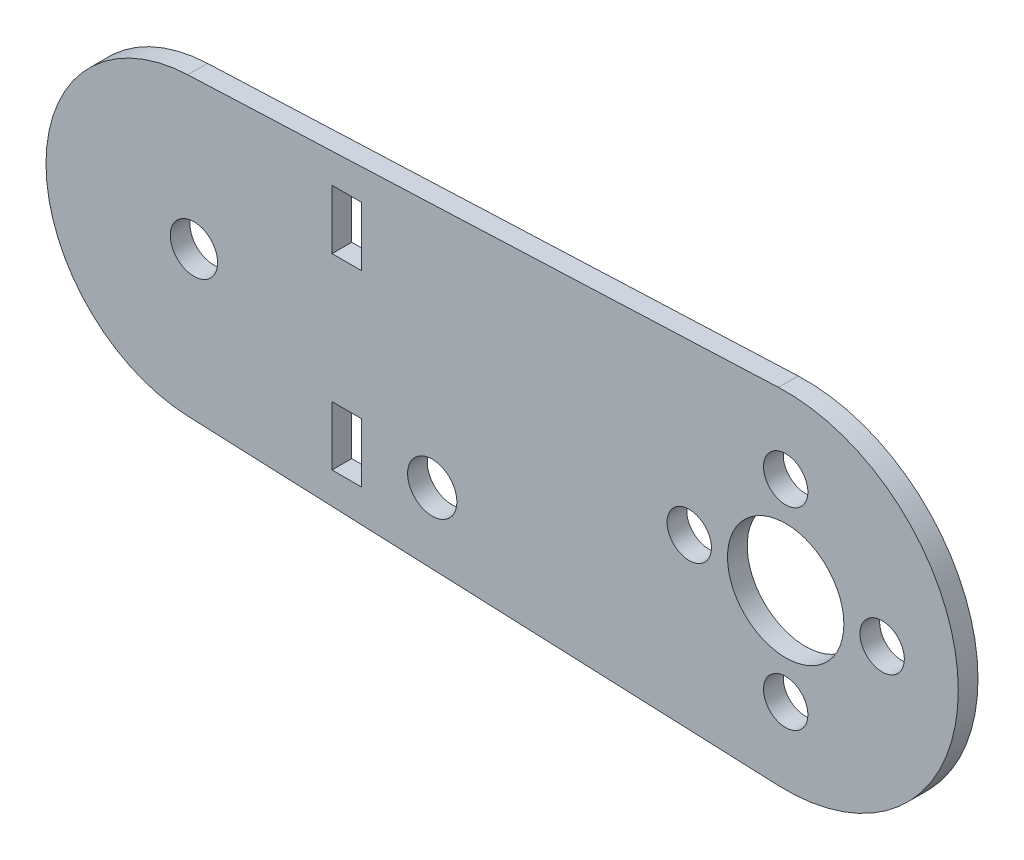
from build123d import *

# Parameters (mm, degrees)
SKETCH1_R           = 17.5
SKETCH1_R_2         = 5.9
SKETCH1_R_3         = 15
BOSS_EXTRUDE1_DEPTH = 2
SKETCH2_R           = 2.25
CUT_EXTRUDE1_DEPTH  = 78.040573726
SKETCH3_R           = 2.4
CUT_EXTRUDE2_DEPTH  = 78.040573726
SKETCH4_W           = 3
SKETCH4_H           = 6
CUT_EXTRUDE3_DEPTH  = 10
SKETCH5_R           = 2.5
CUT_EXTRUDE4_DEPTH  = 78.040573726


with BuildPart() as part:
    # Sketch1 → Boss-Extrude1 (new body)
    # profile 1 of 3: a face of its own
    with BuildSketch(Plane.XY):
        Circle(SKETCH1_R)
        Circle(SKETCH1_R_2, mode=Mode.SUBTRACT)
    # profile 2 of 3: a face of its own
    with BuildSketch(Plane.XY):
        with Locations((-60, 0)):
            Circle(SKETCH1_R_3)
    # profile 3 of 3: a face of its own
    with BuildSketch(Plane.XY):
        with BuildLine():
            Line((-0.729166667, 17.484802429), (-60.625, 14.98697351))
            ThreePointArc((-60.625, 14.98697351), (-49.616720171, 10.825317547), (-45, 0))
            ThreePointArc((-45, 0), (-49.616720171, -10.825317547), (-60.625, -14.98697351))
            Line((-60.625, -14.98697351), (-0.729166667, -17.484802429))
            ThreePointArc((-0.729166667, -17.484802429), (-17.5, 0), (-0.729166667, 17.484802429))
        make_face()
    extrude(amount=BOSS_EXTRUDE1_DEPTH)

    # Sketch2 → Cut-Extrude1 (cut, through all)
    with BuildSketch(Plane.XY.offset(2)):
        with Locations((0, 9.78)):
            Circle(SKETCH2_R)
        with Locations((9.78, 0)):
            Circle(SKETCH2_R)
        with Locations((0, -9.78)):
            Circle(SKETCH2_R)
        with Locations((-9.78, 0)):
            Circle(SKETCH2_R)
    extrude(amount=-CUT_EXTRUDE1_DEPTH, mode=Mode.SUBTRACT)

    # Sketch3 → Cut-Extrude2 (cut, through all)
    with BuildSketch(Plane.XY.offset(2)):
        with Locations((-60, 0)):
            Circle(SKETCH3_R)
    extrude(amount=-CUT_EXTRUDE2_DEPTH, mode=Mode.SUBTRACT)

    # Sketch4 → Cut-Extrude3 (cut)
    with BuildSketch(Plane.XY.offset(2)):
        with Locations((-44.5, -9.405729391)):
            Rectangle(SKETCH4_W, SKETCH4_H)
        with Locations((-44.5, 9.594270609)):
            Rectangle(SKETCH4_W, SKETCH4_H)
    extrude(amount=-CUT_EXTRUDE3_DEPTH, mode=Mode.SUBTRACT)

    # Sketch5 → Cut-Extrude4 (cut, through all)
    with BuildSketch(Plane.XY.offset(2)):
        with Locations((-35.840347269, -8.875222906)):
            Circle(SKETCH5_R)
    extrude(amount=-CUT_EXTRUDE4_DEPTH, mode=Mode.SUBTRACT)


solid = part.part
